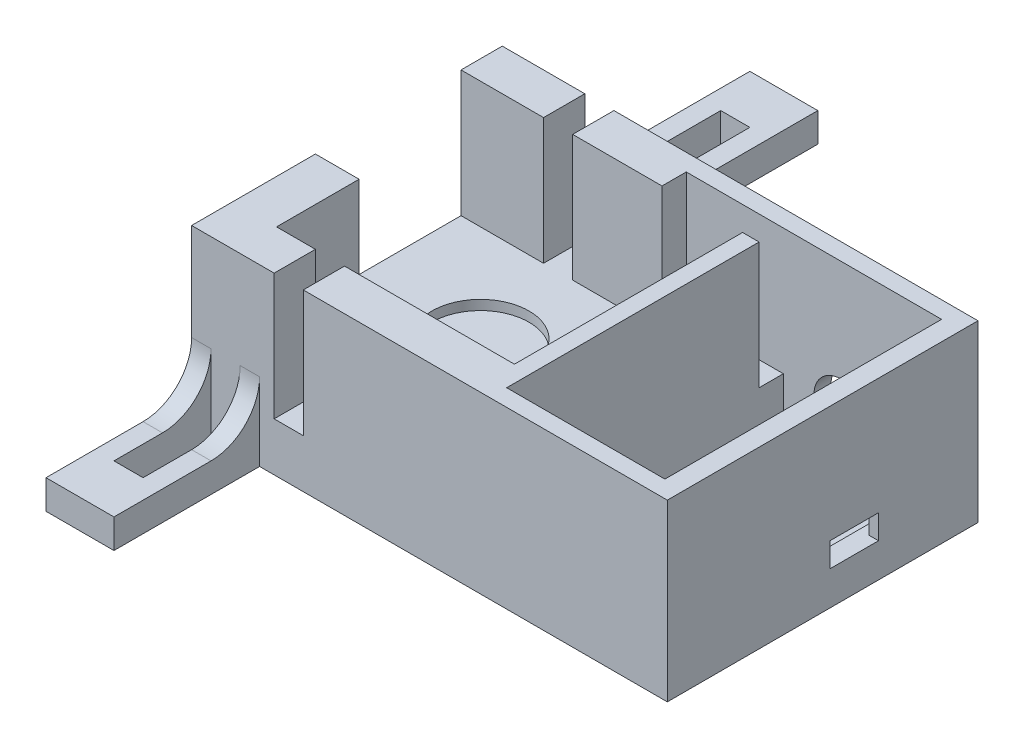
from build123d import *

# Parameters (mm, degrees)
SKETCH_1_W           = 49
SKETCH_1_H           = 32
EXTRUDE_2_DEPTH      = 18
SKETCH_6_W           = 24.5
SKETCH_6_H           = 23.5
CUT_EXTRUDE_1_DEPTH  = 13
SKETCH_7_W           = 16.3
SKETCH_7_H           = 28.5
CUT_EXTRUDE_2_DEPTH  = 16.5
SKETCH_8_W           = 3
SKETCH_8_H           = 32
CUT_EXTRUDE_3_DEPTH  = 13
SKETCH_12_W          = 15
SKETCH_12_H          = 13
CUT_EXTRUDE_5_DEPTH  = 58.690987164
SKETCH_13_W          = 10
SKETCH_13_H          = 2.5
CUT_EXTRUDE_6_DEPTH  = 13
CUT_EXTRUDE_7_DEPTH  = 61.332930477
SKETCH_15_W          = 7
SKETCH_15_H          = 25.5
EXTRUDE_3_DEPTH      = 3
SKETCH_16_W          = 7
SKETCH_16_H          = 15
EXTRUDE_4_DEPTH      = 3
FILLET_1_R           = 5
SKETCH_17_W          = 3
SKETCH_17_H          = 10
SKETCH_17_H_2        = 20.5
CUT_EXTRUDE_8_DEPTH  = 78.661122835
SKETCH_19_R          = 5
CUT_EXTRUDE_9_DEPTH  = 1
CUT_EXTRUDE_10_DEPTH = 1
SKETCH_25_W          = 5
SKETCH_25_H          = 2.5
CUT_EXTRUDE_13_DEPTH = 78.034083366


with BuildPart() as part:
    # 草图1 → 凸台-拉伸2 (new body)
    with BuildSketch(Plane(origin=(0, 0, 0), x_dir=(1, 0, 0), z_dir=(0, 1, 0))):
        with Locations((24.5, 16)):
            Rectangle(SKETCH_1_W, SKETCH_1_H)
    extrude(amount=EXTRUDE_2_DEPTH)

    # 草图6 → 切除-拉伸1 (cut)
    with BuildSketch(Plane(origin=(0, 18, 0), x_dir=(1, 0, 0), z_dir=(0, 1, 0))):
        with Locations((16.75, 16)):
            Rectangle(SKETCH_6_W, SKETCH_6_H)
    extrude(amount=-CUT_EXTRUDE_1_DEPTH, mode=Mode.SUBTRACT)

    # 草图7 → 切除-拉伸2 (cut)
    with BuildSketch(Plane(origin=(0, 18, 0), x_dir=(1, 0, 0), z_dir=(0, 1, 0))):
        with Locations((38.85, 16)):
            Rectangle(SKETCH_7_W, SKETCH_7_H)
    extrude(amount=-CUT_EXTRUDE_2_DEPTH, mode=Mode.SUBTRACT)

    # 草图8 → 切除-拉伸3 (cut)
    with BuildSketch(Plane(origin=(0, 18, 0), x_dir=(1, 0, 0), z_dir=(0, 1, 0))):
        with Locations((10, 16)):
            Rectangle(SKETCH_8_W, SKETCH_8_H)
    extrude(amount=-CUT_EXTRUDE_3_DEPTH, mode=Mode.SUBTRACT)

    # 草图12 → 切除-拉伸5 (cut, through all)
    with BuildSketch(Plane(origin=(4.5, 0, 0), x_dir=(0, 0, -1), z_dir=(1, 0, 0))):
        with Locations((20.25, 11.5)):
            Rectangle(SKETCH_12_W, SKETCH_12_H)
    extrude(amount=-CUT_EXTRUDE_5_DEPTH, mode=Mode.SUBTRACT)

    # 草图13 → 切除-拉伸6 (cut)
    with BuildSketch(Plane(origin=(0, 18, 0), x_dir=(1, 0, 0), z_dir=(0, 1, 0))):
        with Locations((25.7, 29)):
            Rectangle(SKETCH_13_W, SKETCH_13_H)
    extrude(amount=-CUT_EXTRUDE_6_DEPTH, mode=Mode.SUBTRACT)

    # 草图14 → 切除-拉伸7 (cut, through all)
    with BuildSketch(Plane(origin=(0, 0, -1.75), x_dir=(-1, 0, 0), z_dir=(0, 0, -1))):
        with BuildLine():
            Line((-41.05, 7.5), (-36.65, 7.5))
            ThreePointArc((-36.65, 7.5), (-33.85, 4.7), (-36.65, 1.9))
            Line((-36.65, 1.9), (-41.05, 1.9))
            ThreePointArc((-41.05, 1.9), (-43.85, 4.7), (-41.05, 7.5))
        make_face()
    extrude(amount=CUT_EXTRUDE_7_DEPTH, mode=Mode.SUBTRACT)

    # 草图15 → 凸台-拉伸3 (add)
    with BuildSketch(Plane(origin=(0, 0, 0), x_dir=(-1, 0, 0), z_dir=(0, -1, 0))):
        with Locations((-3.5, 44.75)):
            Rectangle(SKETCH_15_W, SKETCH_15_H)
    extrude(amount=-EXTRUDE_3_DEPTH)

    # 草图16 → 凸台-拉伸4 (add)
    with BuildSketch(Plane.XZ):
        with Locations((3.5, 7.5)):
            Rectangle(SKETCH_16_W, SKETCH_16_H)
    extrude(amount=-EXTRUDE_4_DEPTH)

    # 圆角1
    fillet_1_edges = [part.edges().sort_by_distance(p)[0] for p in [
        (3.5, 3, -32),
        (3.5, 3, 0),
    ]]
    fillet(fillet_1_edges, radius=FILLET_1_R)

    # 草图17 → 切除-拉伸8 (cut, through all)
    with BuildSketch(Plane(origin=(0, 0, 0), x_dir=(-1, 0, 0), z_dir=(0, -1, 0))):
        with Locations((-3.5, -5)):
            Rectangle(SKETCH_17_W, SKETCH_17_H)
        with Locations((-3.5, 42.25)):
            Rectangle(SKETCH_17_W, SKETCH_17_H_2)
    extrude(amount=-CUT_EXTRUDE_8_DEPTH, mode=Mode.SUBTRACT)

    # 草图19 → 切除-拉伸9 (cut)
    with BuildSketch(Plane(origin=(0, 5, 0), x_dir=(1, 0, 0), z_dir=(0, 1, 0))):
        with Locations(Location((12, 17.75, 0), (0, 0, 270))):
            Circle(SKETCH_19_R)
    extrude(amount=-CUT_EXTRUDE_9_DEPTH, mode=Mode.SUBTRACT)

    # 草图20 → 切除-拉伸10 (cut)
    with BuildSketch(Plane.ZY.offset(-47)):
        Polygon((-23.75, 3.5), (-14.75, 3.5), (-14.75, 6), (-14.75, 8), (-16.75, 8), (-16.75, 6), (-21.75, 6), (-21.75, 8), (-23.75, 8), (-23.75, 6), align=None)
    extrude(amount=-CUT_EXTRUDE_10_DEPTH, mode=Mode.SUBTRACT)

    # 草图25 → 切除-拉伸13 (cut, through all)
    with BuildSketch(Plane.ZY.offset(-48)):
        with Locations((-19.25, 4.75)):
            Rectangle(SKETCH_25_W, SKETCH_25_H)
    extrude(amount=-CUT_EXTRUDE_13_DEPTH, mode=Mode.SUBTRACT)


solid = part.part
